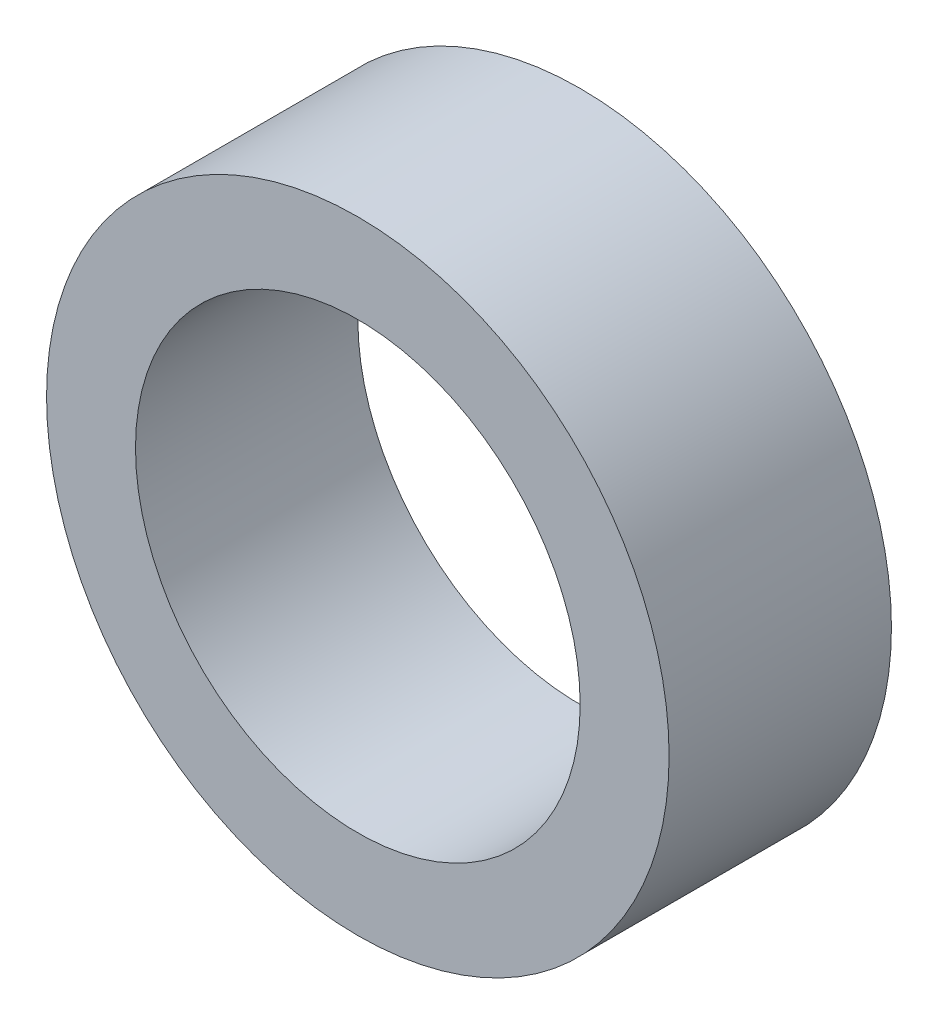
from build123d import *

# Parameters (mm, degrees)
SKETCH1_R           = 3.5
SKETCH1_R_2         = 2.5
BOSS_EXTRUDE1_DEPTH = 2.5


with BuildPart() as part:
    # Sketch1 → Boss-Extrude1 (new body)
    with BuildSketch(Plane.XY):
        Circle(SKETCH1_R)
        Circle(SKETCH1_R_2, mode=Mode.SUBTRACT)
    extrude(amount=BOSS_EXTRUDE1_DEPTH)


solid = part.part
